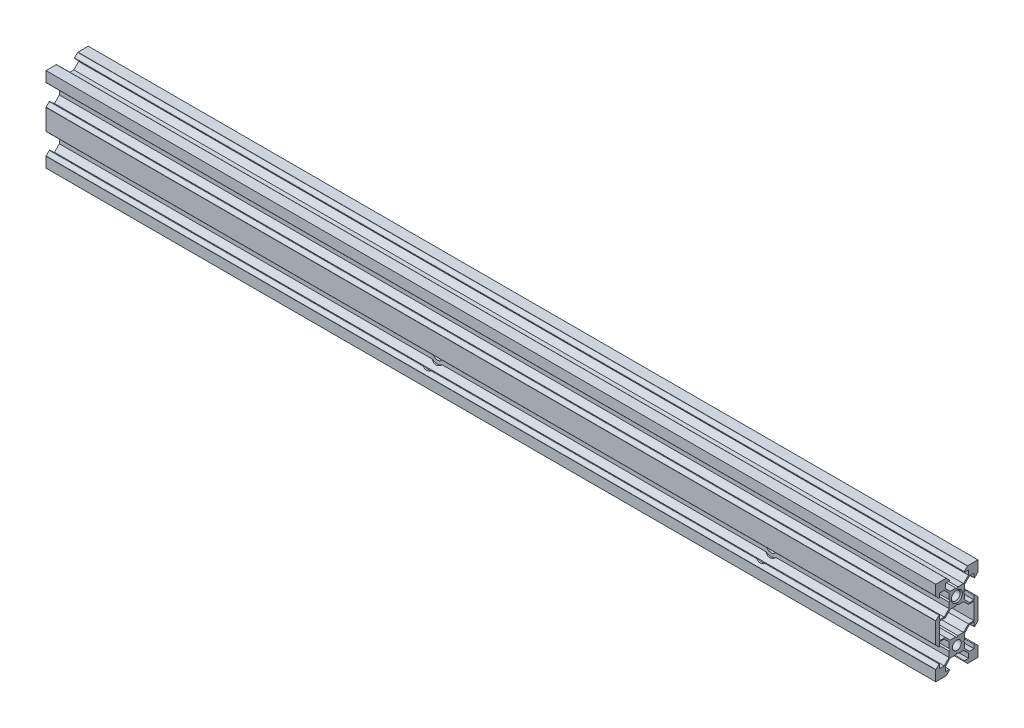
from build123d import *

# Parameters (mm, degrees)
MAIN_BODY_DEPTH                 = 200
MAIN_BODY_DEPTH_BACK            = 200
SKETCH2_R                       = 2
CHAMFER1_SIZE                   = 0.5
CHAMFER2_SIZE                   = 0.5
SCREW_HOLES_DEPTH               = 203.243276711
SCREW_HOLES_DEPTH_BACK          = 203.243276711
SKETCH3_R                       = 2.25
SCREW_CLEARANCE_HOLE_DEPTH      = 203.911423797
SCREW_CLEARANCE_HOLE_DEPTH_BACK = 5.999174
SKETCH4_R                       = 3.75


with BuildPart() as part:
    # Sketch2 → Main Body (new, two sides: drawn at the far end of the back side and taken through both)
    with BuildSketch(Plane(origin=(0, 0, 0), x_dir=(0, 0, -1), z_dir=(1, 0, 0)).offset(-MAIN_BODY_DEPTH_BACK)):
        with BuildLine():
            Line((0, 3), (-0.5, 3.5))
            Line((-0.5, 3.5), (-3.01, 3.5))
            Line((-3.01, 3.5), (-5.209102089, 5.699102089))
            Line((-5.209102089, 5.699102089), (-5.209102089, 7.699102089))
            Line((-5.209102089, 7.699102089), (-3.479102089, 7.699102089))
            ThreePointArc((-3.479102089, 7.699102089), (-3.294326183, 7.822565403), (-3.337680733, 8.040523446))
            Line((-3.337680733, 8.040523446), (-4.73775216, 9.440594872))
            ThreePointArc((-4.73775216, 9.440594872), (-4.80263683, 9.483949423), (-4.879173516, 9.499173516))
            Line((-4.879173516, 9.499173516), (-9.499173516, 9.499173516))
            Line((-9.499173516, 9.499173516), (-9.499173516, 4.879173516))
            ThreePointArc((-9.499173516, 4.879173516), (-9.483949423, 4.80263683), (-9.440594872, 4.73775216))
            Line((-9.440594872, 4.73775216), (-8.040523446, 3.337680733))
            ThreePointArc((-8.040523446, 3.337680733), (-7.822565403, 3.294326183), (-7.699102089, 3.479102089))
            Line((-7.699102089, 3.479102089), (-7.699102089, 5.209102089))
            Line((-7.699102089, 5.209102089), (-5.699102089, 5.209102089))
            Line((-5.699102089, 5.209102089), (-3.5, 3.01))
            Line((-3.5, 3.01), (-3.5, 0.5))
            Line((-3.5, 0.5), (-3, 0))
            Line((-3, 0), (-3.5, -0.5))
            Line((-3.5, -0.5), (-3.5, -3.01))
            Line((-3.5, -3.01), (-5.699102089, -5.209102089))
            Line((-5.699102089, -5.209102089), (-7.699102089, -5.209102089))
            Line((-7.699102089, -5.209102089), (-7.699102089, -3.479102089))
            ThreePointArc((-7.699102089, -3.479102089), (-7.822565403, -3.294326183), (-8.040523446, -3.337680733))
            Line((-8.040523446, -3.337680733), (-9.440594872, -4.73775216))
            ThreePointArc((-9.440594872, -4.73775216), (-9.483949423, -4.80263683), (-9.499173516, -4.879173516))
            Line((-9.499173516, -4.879173516), (-9.499173516, -14.119173516))
            ThreePointArc((-9.499173516, -14.119173516), (-9.483949423, -14.195710203), (-9.440594872, -14.260594872))
            Line((-9.440594872, -14.260594872), (-8.040523446, -15.660666299))
            ThreePointArc((-8.040523446, -15.660666299), (-7.822565403, -15.704020849), (-7.699102089, -15.519244943))
            Line((-7.699102089, -15.519244943), (-7.699102089, -13.789244943))
            Line((-7.699102089, -13.789244943), (-5.699102089, -13.789244943))
            Line((-5.699102089, -13.789244943), (-3.5, -15.988347032))
            Line((-3.5, -15.988347032), (-3.5, -18.498347032))
            Line((-3.5, -18.498347032), (-3, -18.998347032))
            Line((-3, -18.998347032), (-3.5, -19.498347032))
            Line((-3.5, -19.498347032), (-3.5, -22.008347032))
            Line((-3.5, -22.008347032), (-5.699102089, -24.207449122))
            Line((-5.699102089, -24.207449122), (-7.699102089, -24.207449122))
            Line((-7.699102089, -24.207449122), (-7.699102089, -22.477449122))
            ThreePointArc((-7.699102089, -22.477449122), (-7.822565403, -22.292673215), (-8.040523446, -22.336027766))
            Line((-8.040523446, -22.336027766), (-9.440594872, -23.736099192))
            ThreePointArc((-9.440594872, -23.736099192), (-9.483949423, -23.800983862), (-9.499173516, -23.877520549))
            Line((-9.499173516, -23.877520549), (-9.499173516, -28.497520549))
            Line((-9.499173516, -28.497520549), (-4.879173516, -28.497520549))
            ThreePointArc((-4.879173516, -28.497520549), (-4.80263683, -28.482296455), (-4.73775216, -28.438941905))
            Line((-4.73775216, -28.438941905), (-3.337680733, -27.038870478))
            ThreePointArc((-3.337680733, -27.038870478), (-3.294326183, -26.820912435), (-3.479102089, -26.697449122))
            Line((-3.479102089, -26.697449122), (-5.209102089, -26.697449122))
            Line((-5.209102089, -26.697449122), (-5.209102089, -24.697449122))
            Line((-5.209102089, -24.697449122), (-3.01, -22.498347032))
            Line((-3.01, -22.498347032), (-0.5, -22.498347032))
            Line((-0.5, -22.498347032), (0, -21.998347032))
            Line((0, -21.998347032), (0.5, -22.498347032))
            Line((0.5, -22.498347032), (3.01, -22.498347032))
            Line((3.01, -22.498347032), (5.209102089, -24.697449122))
            Line((5.209102089, -24.697449122), (5.209102089, -26.697449122))
            Line((5.209102089, -26.697449122), (3.479102089, -26.697449122))
            ThreePointArc((3.479102089, -26.697449122), (3.294326183, -26.820912435), (3.337680733, -27.038870478))
            Line((3.337680733, -27.038870478), (4.73775216, -28.438941905))
            ThreePointArc((4.73775216, -28.438941905), (4.80263683, -28.482296455), (4.879173516, -28.497520549))
            Line((4.879173516, -28.497520549), (9.499173516, -28.497520549))
            Line((9.499173516, -28.497520549), (9.499173516, -23.877520549))
            ThreePointArc((9.499173516, -23.877520549), (9.483949423, -23.800983862), (9.440594872, -23.736099192))
            Line((9.440594872, -23.736099192), (8.040523446, -22.336027766))
            ThreePointArc((8.040523446, -22.336027766), (7.822565403, -22.292673215), (7.699102089, -22.477449122))
            Line((7.699102089, -22.477449122), (7.699102089, -24.207449122))
            Line((7.699102089, -24.207449122), (5.699102089, -24.207449122))
            Line((5.699102089, -24.207449122), (3.5, -22.008347032))
            Line((3.5, -22.008347032), (3.5, -19.498347032))
            Line((3.5, -19.498347032), (3, -18.998347032))
            Line((3, -18.998347032), (3.5, -18.498347032))
            Line((3.5, -18.498347032), (3.5, -15.988347032))
            Line((3.5, -15.988347032), (5.699102089, -13.789244943))
            Line((5.699102089, -13.789244943), (7.699102089, -13.789244943))
            Line((7.699102089, -13.789244943), (7.699102089, -15.519244943))
            ThreePointArc((7.699102089, -15.519244943), (7.822565403, -15.704020849), (8.040523446, -15.660666299))
            Line((8.040523446, -15.660666299), (9.440594872, -14.260594872))
            ThreePointArc((9.440594872, -14.260594872), (9.483949423, -14.195710203), (9.499173516, -14.119173516))
            Line((9.499173516, -14.119173516), (9.499173516, -4.879173516))
            ThreePointArc((9.499173516, -4.879173516), (9.483949423, -4.80263683), (9.440594872, -4.73775216))
            Line((9.440594872, -4.73775216), (8.040523446, -3.337680733))
            ThreePointArc((8.040523446, -3.337680733), (7.822565403, -3.294326183), (7.699102089, -3.479102089))
            Line((7.699102089, -3.479102089), (7.699102089, -5.209102089))
            Line((7.699102089, -5.209102089), (5.699102089, -5.209102089))
            Line((5.699102089, -5.209102089), (3.5, -3.01))
            Line((3.5, -3.01), (3.5, -0.5))
            Line((3.5, -0.5), (3, 0))
            Line((3, 0), (3.5, 0.5))
            Line((3.5, 0.5), (3.5, 3.01))
            Line((3.5, 3.01), (5.699102089, 5.209102089))
            Line((5.699102089, 5.209102089), (7.699102089, 5.209102089))
            Line((7.699102089, 5.209102089), (7.699102089, 3.479102089))
            ThreePointArc((7.699102089, 3.479102089), (7.822565403, 3.294326183), (8.040523446, 3.337680733))
            Line((8.040523446, 3.337680733), (9.440594872, 4.73775216))
            ThreePointArc((9.440594872, 4.73775216), (9.483949423, 4.80263683), (9.499173516, 4.879173516))
            Line((9.499173516, 4.879173516), (9.499173516, 9.499173516))
            Line((9.499173516, 9.499173516), (4.879173516, 9.499173516))
            ThreePointArc((4.879173516, 9.499173516), (4.80263683, 9.483949423), (4.73775216, 9.440594872))
            Line((4.73775216, 9.440594872), (3.337680733, 8.040523446))
            ThreePointArc((3.337680733, 8.040523446), (3.294326183, 7.822565403), (3.479102089, 7.699102089))
            Line((3.479102089, 7.699102089), (5.209102089, 7.699102089))
            Line((5.209102089, 7.699102089), (5.209102089, 5.699102089))
            Line((5.209102089, 5.699102089), (3.01, 3.5))
            Line((3.01, 3.5), (0.5, 3.5))
            Line((0.5, 3.5), (0, 3))
        make_face()
        Circle(SKETCH2_R, mode=Mode.SUBTRACT)
        with Locations((0, -18.998347032)):
            Circle(SKETCH2_R, mode=Mode.SUBTRACT)
        Polygon((0, -3), (0.5, -3.5), (3.01, -3.5), (5.209102089, -5.699102089), (7.699102089, -5.699102089), (7.699102089, -13.299244943), (5.209102089, -13.299244943), (3.01, -15.498347032), (0.5, -15.498347032), (0, -15.998347032), (-0.5, -15.498347032), (-3.01, -15.498347032), (-5.209102089, -13.299244943), (-7.699102089, -13.299244943), (-7.699102089, -5.699102089), (-5.209102089, -5.699102089), (-3.01, -3.5), (-0.5, -3.5), align=None, mode=Mode.SUBTRACT)
    extrude(amount=MAIN_BODY_DEPTH + MAIN_BODY_DEPTH_BACK)

    # Chamfer1
    chamfer1_edges = [part.edges().sort_by_distance(p)[0] for p in [
        (200, 0, 2),
    ]]
    chamfer(chamfer1_edges, length=CHAMFER1_SIZE)

    # Chamfer2
    chamfer2_edges = [part.edges().sort_by_distance(p)[0] for p in [
        (-200, 0, 2),
    ]]
    chamfer(chamfer2_edges, length=CHAMFER2_SIZE)

    # Sketch3 → Screw Holes (cut, two sides: drawn at the far end of the back side and taken through both)
    with BuildSketch(Plane.XY.offset(-SCREW_HOLES_DEPTH_BACK)):
        with Locations((-30, -18.998347032)):
            Circle(SKETCH3_R)
        with Locations((120, -18.998347032)):
            Circle(SKETCH3_R)
    extrude(amount=SCREW_HOLES_DEPTH + SCREW_HOLES_DEPTH_BACK, mode=Mode.SUBTRACT)

    # Sketch4 → Screw Clearance Hole (cut, two sides: drawn at the far end of the back side and taken through both)
    with BuildSketch(Plane.XY.offset(9.499173516).offset(-SCREW_CLEARANCE_HOLE_DEPTH_BACK)):
        with Locations((-30, -18.998347032)):
            Circle(SKETCH4_R)
        with Locations((120, -18.998347032)):
            Circle(SKETCH4_R)
    extrude(amount=SCREW_CLEARANCE_HOLE_DEPTH + SCREW_CLEARANCE_HOLE_DEPTH_BACK, mode=Mode.SUBTRACT)


solid = part.part
